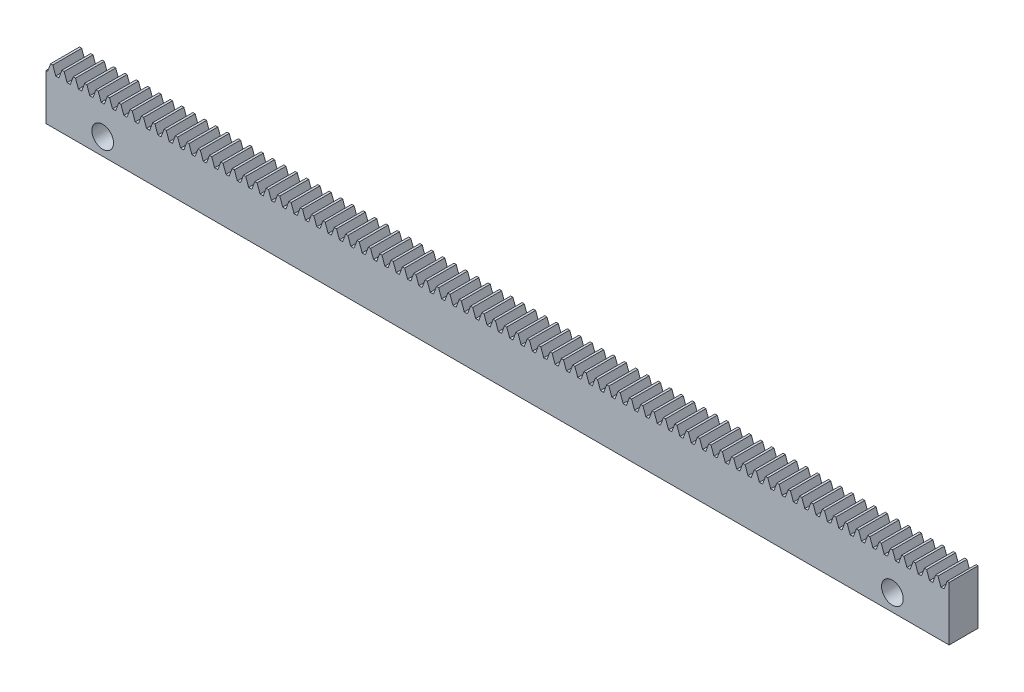
from build123d import *

# Parameters (mm, degrees)
BLANKSKE_W         = 125
BLANKSKE_H         = 7.5
BLANK_DEPTH        = 4
TOOTHCUTSIM_DEPTH  = 126.288666686
TEETHCUTS_COUNT    = 80
TEETHCUTS_PITCH    = 1.570796325
SKETCH1_R          = 1.5
CUT_EXTRUDE1_DEPTH = 126.288666686


with BuildPart() as part:
    # BlankSke → Blank (new body)
    with BuildSketch(Plane.XY):
        with Locations((62.5, 3.75)):
            Rectangle(BLANKSKE_W, BLANKSKE_H)
    extrude(amount=-BLANK_DEPTH)

    # TooCutSkeSim → ToothCutSim (cut, through all)
    with BuildSketch(Plane.XY):
        Polygon((0.222217685, 6.375), (-0.222217685, 6.375), (-0.640929042, 7.5254), (0.640929042, 7.5254), align=None)
    toothcutsim = extrude(amount=-TOOTHCUTSIM_DEPTH, mode=Mode.SUBTRACT)

    # TeethCuts: ToothCutSim ×80
    with Locations(*[(i * TEETHCUTS_PITCH, 0, 0) for i in range(1, TEETHCUTS_COUNT)]):
        add(toothcutsim, mode=Mode.SUBTRACT)

    # Sketch1 → Cut-Extrude1 (cut, through all)
    with BuildSketch(Plane(origin=(0, 0, -4), x_dir=(-1, 0, 0), z_dir=(0, 0, -1))):
        with Locations((-7.85, 2.35)):
            Circle(SKETCH1_R)
        with Locations((-117.15, 2.35)):
            Circle(SKETCH1_R)
    extrude(amount=-CUT_EXTRUDE1_DEPTH, mode=Mode.SUBTRACT)


solid = part.part
